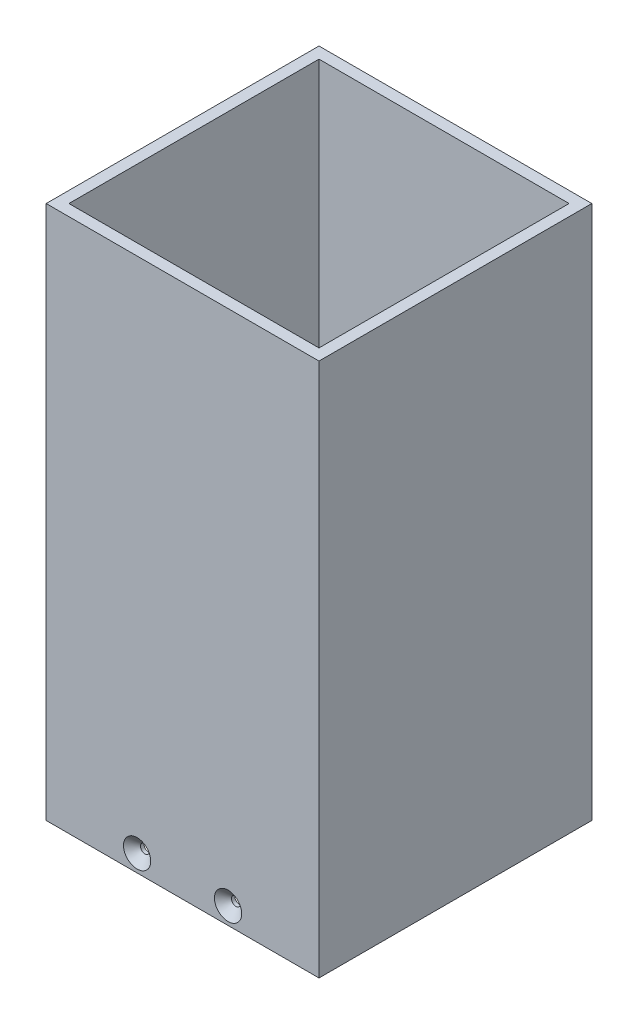
from build123d import *
from OCP.BRepFilletAPI import BRepFilletAPI_MakeChamfer

# Parameters (mm, degrees)
SKETCH1_W           = 76.2
SKETCH1_H           = 76.2
SKETCH1_W_2         = 69.85
SKETCH1_H_2         = 69.85
BOSS_EXTRUDE1_DEPTH = 9.525
SKETCH2_R           = 1.26365
CUT_EXTRUDE1_DEPTH  = 86.725
CHAMFER1_SIZE       = 2.54
CHAMFER1_SIZE2      = 2.207988314
SKETCH3_W           = 76.2
SKETCH3_H           = 76.2
SKETCH3_W_2         = 69.85
SKETCH3_H_2         = 69.85
BOSS_EXTRUDE2_DEPTH = 139.7


with BuildPart() as part:
    # Sketch1 → Boss-Extrude1 (new body)
    with BuildSketch(Plane(origin=(0, 0, 0), x_dir=(1, 0, 0), z_dir=(0, 1, 0))):
        Rectangle(SKETCH1_W, SKETCH1_H)
        Rectangle(SKETCH1_W_2, SKETCH1_H_2, mode=Mode.SUBTRACT)
    extrude(amount=BOSS_EXTRUDE1_DEPTH)

    # Sketch2 → Cut-Extrude1 (cut, through all)
    with BuildSketch(Plane.XY.offset(38.1)):
        with Locations((-12.7, 4.7625)):
            Circle(SKETCH2_R)
        with Locations((12.7, 4.7625)):
            Circle(SKETCH2_R)
    extrude(amount=-CUT_EXTRUDE1_DEPTH, mode=Mode.SUBTRACT)

    # Chamfer1: one chamfer whose edges measure the first distance from different faces: ONE call of the kernel's chamfer builder (chamfer() names one face for all edges)
    chamfer1_edges_1 = [part.edges().sort_by_distance(p)[0] for p in [
        (-13.96365, 4.7625, -38.1),
    ]]
    chamfer1_side_1 = [part.faces().sort_by_distance(p)[0] for p in [
        (-13.96365, 4.7625, -36.5125),
    ]]
    chamfer1_edges_2 = [part.edges().sort_by_distance(p)[0] for p in [
        (-13.96365, 4.7625, 38.1),
        (11.43635, 4.7625, 38.1),
    ]]
    chamfer1_side_2 = [part.faces().sort_by_distance(p)[0] for p in [
        (0, 4.7625, 38.1),
    ]]
    chamfer1_edges_3 = [part.edges().sort_by_distance(p)[0] for p in [
        (11.43635, 4.7625, -38.1),
    ]]
    chamfer1_side_3 = [part.faces().sort_by_distance(p)[0] for p in [
        (11.43635, 4.7625, -36.5125),
    ]]
    chamfer1 = BRepFilletAPI_MakeChamfer(part.part.solid().wrapped)
    for e in chamfer1_edges_1:
        chamfer1.Add(CHAMFER1_SIZE, CHAMFER1_SIZE2, e.wrapped, chamfer1_side_1[0].wrapped)  # the first distance lies on this face
    for e in chamfer1_edges_2:
        chamfer1.Add(CHAMFER1_SIZE, CHAMFER1_SIZE2, e.wrapped, chamfer1_side_2[0].wrapped)  # the first distance lies on this face
    for e in chamfer1_edges_3:
        chamfer1.Add(CHAMFER1_SIZE, CHAMFER1_SIZE2, e.wrapped, chamfer1_side_3[0].wrapped)  # the first distance lies on this face
    add(Compound.cast(chamfer1.Shape()), mode=Mode.REPLACE)

    # Sketch3 → Boss-Extrude2 (add)
    with BuildSketch(Plane(origin=(0, 9.525, 0), x_dir=(1, 0, 0), z_dir=(0, 1, 0))):
        Rectangle(SKETCH3_W, SKETCH3_H)
        Rectangle(SKETCH3_W_2, SKETCH3_H_2, mode=Mode.SUBTRACT)
    extrude(amount=BOSS_EXTRUDE2_DEPTH)


solid = part.part
